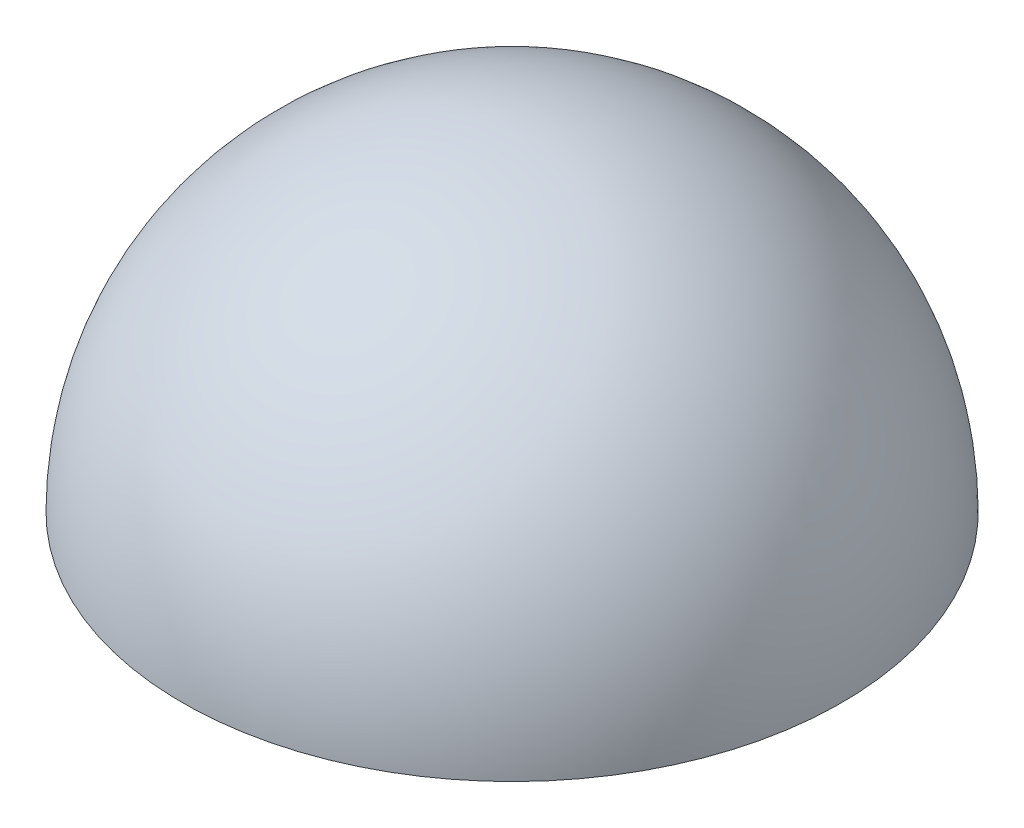
from build123d import *

# Parameters (mm, degrees)
REVOLVE1_ANGLE = 180


with BuildPart() as part:
    # Sketch1 → Revolve1 (revolve)
    with BuildSketch(Plane(origin=(0, 0, 0), x_dir=(1, 0, 0), z_dir=(0, 1, 0))):
        with BuildLine():
            Line((-44.45, 0), (44.45, 0))
            ThreePointArc((44.45, 0), (0, 44.45), (-44.45, 0))
        make_face()
    revolve(axis=Axis((-44.45, 0, 0), (1, 0, 0)), revolution_arc=REVOLVE1_ANGLE)


solid = part.part
